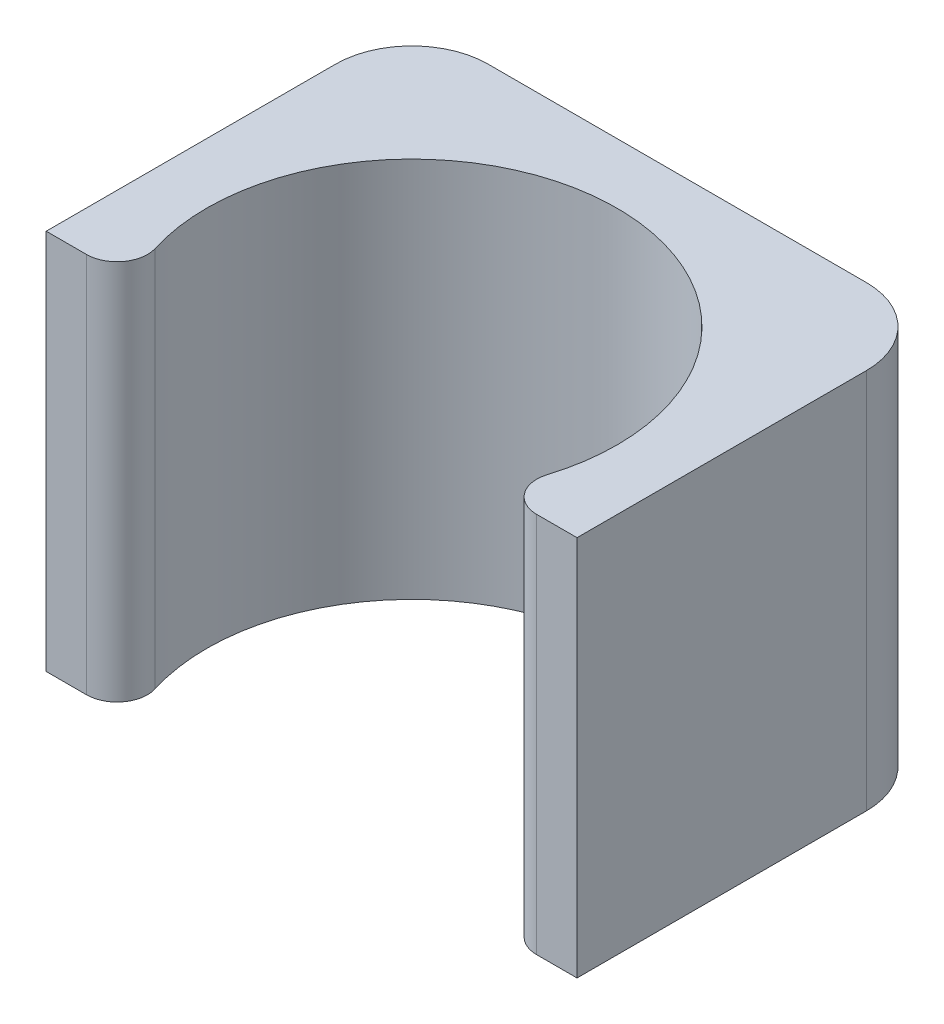
from build123d import *

# Parameters (mm, degrees)
BOSS_EXTRUDE1_DEPTH = 25
FILLET1_R           = 5


with BuildPart() as part:
    # Sketch1 → Boss-Extrude1 (new body)
    with BuildSketch(Plane(origin=(0, 0, 0), x_dir=(1, 0, 0), z_dir=(0, 1, 0))):
        with BuildLine():
            Line((-34.8, 0), (-34.8, -23.97))
            Line((-34.8, -23.97), (-32.158644924, -23.97))
            ThreePointArc((-32.158644924, -23.97), (-30.548804634, -23.156766295), (-30.248140727, -21.378414239))
            ThreePointArc((-30.248140727, -21.378414239), (-17.4, -3.95), (-4.551859273, -21.378414239))
            ThreePointArc((-4.551859273, -21.378414239), (-4.251195366, -23.156766295), (-2.641355076, -23.97))
            Line((-2.641355076, -23.97), (0, -23.97))
            Line((0, -23.97), (0, 0))
            Line((0, 0), (-34.8, 0))
        make_face()
    extrude(amount=BOSS_EXTRUDE1_DEPTH)

    # Fillet1
    fillet1_edges = [part.edges().sort_by_distance(p)[0] for p in [
        (0, 12.5, 0),
        (-34.8, 12.5, 0),
    ]]
    fillet(fillet1_edges, radius=FILLET1_R)


solid = part.part
